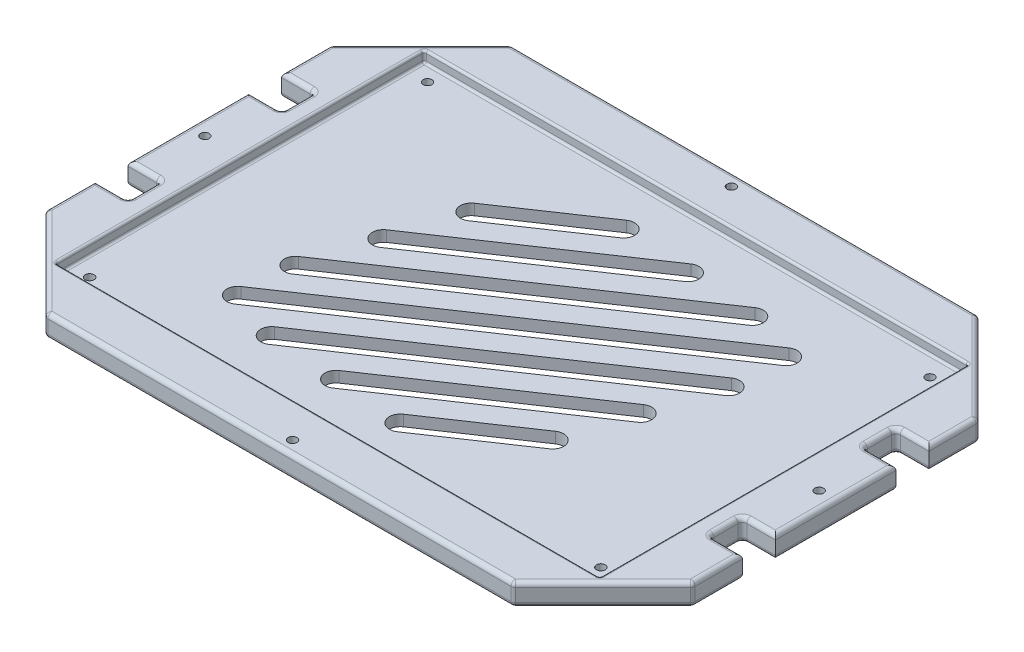
from build123d import *

# Parameters (mm, degrees)
BOSS_EXTRUDE1_DEPTH     = 5
SKETCH4_W               = 248
SKETCH4_H               = 168
CUT_EXTRUDE2_DEPTH      = 5
SKETCH5_R               = 2
SKETCH5_W               = 15
SKETCH5_H               = 15
CUT_EXTRUDE3_DEPTH      = 182.912753813
CUT_EXTRUDE4_DEPTH      = 182.912753813
CUT_EXTRUDE4_DEPTH_BACK = 182.912753813
SKETCH4_3_R             = 2
FILLET1_R               = 2
FILLET2_R               = 1
CUT_EXTRUDE6_DEPTH      = 182.706494105
CUT_EXTRUDE6_DEPTH_BACK = 182.706494105


with BuildPart() as part:
    # Sketch1 → Boss-Extrude1 (new, symmetric)
    with BuildSketch(Plane(origin=(0, 0, 0), x_dir=(1, 0, 0), z_dir=(0, 1, 0))):
        Polygon((-147.5, 64.895923599), (-147.5, -64.895923599), (-106.395923599, -106), (106.395923599, -106), (147.5, -64.895923599), (147.5, 64.895923599), (106.395923599, 106), (-106.395923599, 106), align=None)
    extrude(amount=BOSS_EXTRUDE1_DEPTH, both=True)

    # Sketch4 → Cut-Extrude2 (cut)
    with BuildSketch(Plane(origin=(0, 5, 0), x_dir=(1, 0, 0), z_dir=(0, 1, 0))):
        Rectangle(SKETCH4_W, SKETCH4_H)
    extrude(amount=-CUT_EXTRUDE2_DEPTH, mode=Mode.SUBTRACT)

    # Sketch5 → Cut-Extrude3 (cut, symmetric)
    with BuildSketch(Plane(origin=(0, 5, 0), x_dir=(1, 0, 0), z_dir=(0, 1, 0))):
        with Locations((-140, 0)):
            Circle(SKETCH5_R)
        with Locations((0, 100)):
            Circle(SKETCH5_R)
        with Locations((0, -100)):
            Circle(SKETCH5_R)
        with Locations((-140, 35)):
            Rectangle(SKETCH5_W, SKETCH5_H)
        with Locations((-140, -35)):
            Rectangle(SKETCH5_W, SKETCH5_H)
    cut_extrude3 = extrude(amount=CUT_EXTRUDE3_DEPTH, both=True, mode=Mode.SUBTRACT)

    # Mirror1: Cut-Extrude3 across plane
    add(cut_extrude3.mirror(Plane(origin=(0, 0, 0), x_dir=(0, 0, 1), z_dir=(1, 0, 0))), mode=Mode.SUBTRACT)

    # Sketch4<3> → Cut-Extrude4 (cut, two sides: drawn at the far end of the back side and taken through both)
    with BuildSketch(Plane(origin=(0, 5, 0), x_dir=(1, 0, 0), z_dir=(0, 1, 0)).offset(-CUT_EXTRUDE4_DEPTH_BACK)):
        with Locations((-115.5, 77)):
            Circle(SKETCH4_3_R)
        with Locations((-115.5, -77)):
            Circle(SKETCH4_3_R)
        with Locations((115.5, 75)):
            Circle(SKETCH4_3_R)
        with Locations((115.5, -75)):
            Circle(SKETCH4_3_R)
    extrude(amount=CUT_EXTRUDE4_DEPTH + CUT_EXTRUDE4_DEPTH_BACK, mode=Mode.SUBTRACT)

    # Fillet1
    fillet1_edges = [part.edges().sort_by_distance(p)[0] for p in [
        (140, 5, 42.5),
        (140, 5, 27.5),
        (140, -5, 27.5),
        (140, -5, 42.5),
        (140, 5, -27.5),
        (140, 5, -42.5),
        (140, -5, -42.5),
        (140, -5, -27.5),
        (-140, -5, 42.5),
        (-140, 5, 42.5),
        (-140, -5, 27.5),
        (-140, 5, 27.5),
        (-140, -5, -27.5),
        (-140, 5, -27.5),
        (-140, -5, -42.5),
        (-140, 5, -42.5),
        (132.5, 5, 35),
        (132.5, 0, 27.5),
        (132.5, -5, 35),
        (132.5, 0, 42.5),
        (132.5, 5, -35),
        (132.5, 0, -42.5),
        (132.5, -5, -35),
        (132.5, 0, -27.5),
        (-132.5, 0, 42.5),
        (-132.5, -5, 35),
        (-132.5, 0, 27.5),
        (-132.5, 5, 35),
        (-132.5, 0, -27.5),
        (-132.5, -5, -35),
        (-132.5, 0, -42.5),
        (-132.5, 5, -35),
        (-126.9479618, -5, 85.4479618),
        (0, -5, 106),
        (126.9479618, -5, 85.4479618),
        (147.5, -5, -53.6979618),
        (147.5, -5, 0),
        (147.5, -5, 53.6979618),
        (126.9479618, -5, -85.4479618),
        (0, -5, -106),
        (-126.9479618, -5, -85.4479618),
        (-147.5, -5, -53.6979618),
        (-147.5, -5, 0),
        (-147.5, -5, 53.6979618),
        (-126.9479618, 5, 85.4479618),
        (0, 5, 106),
        (126.9479618, 5, 85.4479618),
        (147.5, 5, -53.6979618),
        (147.5, 5, 0),
        (147.5, 5, 53.6979618),
        (126.9479618, 5, -85.4479618),
        (0, 5, -106),
        (-126.9479618, 5, -85.4479618),
        (-147.5, 5, -53.6979618),
        (-147.5, 5, 0),
        (-147.5, 5, 53.6979618),
        (-147.5, 0, 64.895923599),
        (-147.5, 0, -64.895923599),
        (-106.395923599, 0, -106),
        (106.395923599, 0, -106),
        (147.5, 0, -64.895923599),
        (-106.395923599, 0, 106),
        (147.5, 0, 64.895923599),
        (106.395923599, 0, 106),
    ]]
    fillet(fillet1_edges, radius=FILLET1_R)

    # Fillet2
    fillet2_edges = [part.edges().sort_by_distance(p)[0] for p in [
        (0, 0, 84),
        (124, 0, 0),
        (0, 0, -84),
        (-124, 0, 0),
        (-124, 2.5, 84),
        (124, 2.5, 84),
        (0, 5, 84),
        (124, 2.5, -84),
        (-124, 2.5, -84),
        (124, 5, 0),
        (0, 5, -84),
        (-124, 5, 0),
    ]]
    fillet(fillet2_edges, radius=FILLET2_R)

    # Sketch7 → Cut-Extrude6 (cut, two sides: drawn at the far end of the back side and taken through both)
    with BuildSketch(Plane(origin=(0, 0, 0), x_dir=(1, 0, 0), z_dir=(0, 1, 0)).offset(-CUT_EXTRUDE6_DEPTH_BACK)):
        with BuildLine():
            Line((-77.400196961, -46.197505456), (71.806625914, 54.486773394))
            ThreePointArc((71.806625914, 54.486773394), (78.748045406, 53.138924949), (77.400196961, 46.197505456))
            Line((77.400196961, 46.197505456), (-71.806625914, -54.486773394))
            ThreePointArc((-71.806625914, -54.486773394), (-78.748045406, -53.138924949), (-77.400196961, -46.197505456))
        make_face()
        with BuildLine():
            Line((-76.153437149, -21.228613011), (48.185581913, 62.674952698))
            ThreePointArc((48.185581913, 62.674952698), (55.127001405, 61.327104253), (53.77915296, 54.385684761))
            Line((53.77915296, 54.385684761), (-70.559866102, -29.517880948))
            ThreePointArc((-70.559866102, -29.517880948), (-77.501285594, -28.170032503), (-76.153437149, -21.228613011))
        make_face()
        with BuildLine():
            Line((-66.6174094, 9.333850482), (16.275269975, 65.269560955))
            ThreePointArc((16.275269975, 65.269560955), (23.216689467, 63.92171251), (21.868841022, 56.980293017))
            Line((21.868841022, 56.980293017), (-61.023838353, 1.044582545))
            ThreePointArc((-61.023838353, 1.044582545), (-67.965257845, 2.39243099), (-66.6174094, 9.333850482))
        make_face()
        with BuildLine():
            Line((-57.081381651, 39.896313976), (-15.635041963, 67.864169212))
            ThreePointArc((-15.635041963, 67.864169212), (-8.693622471, 66.516320767), (-10.041470916, 59.574901274))
            Line((-10.041470916, 59.574901274), (-51.487810604, 31.607046038))
            ThreePointArc((-51.487810604, 31.607046038), (-58.429230096, 32.954894483), (-57.081381651, 39.896313976))
        make_face()
        with BuildLine():
            Line((-48.185581913, -62.674952698), (76.153437149, 21.228613011))
            ThreePointArc((76.153437149, 21.228613011), (77.501285594, 28.170032503), (70.559866102, 29.517880948))
            Line((70.559866102, 29.517880948), (-53.77915296, -54.385684761))
            ThreePointArc((-53.77915296, -54.385684761), (-55.127001405, -61.327104253), (-48.185581913, -62.674952698))
        make_face()
        with BuildLine():
            Line((-16.275269975, -65.269560955), (66.6174094, -9.333850482))
            ThreePointArc((66.6174094, -9.333850482), (67.965257845, -2.39243099), (61.023838353, -1.044582545))
            Line((61.023838353, -1.044582545), (-21.868841022, -56.980293017))
            ThreePointArc((-21.868841022, -56.980293017), (-23.216689467, -63.92171251), (-16.275269975, -65.269560955))
        make_face()
        with BuildLine():
            Line((15.635041963, -67.864169212), (57.081381651, -39.896313976))
            ThreePointArc((57.081381651, -39.896313976), (58.429230096, -32.954894483), (51.487810604, -31.607046038))
            Line((51.487810604, -31.607046038), (10.041470916, -59.574901274))
            ThreePointArc((10.041470916, -59.574901274), (8.693622471, -66.516320767), (15.635041963, -67.864169212))
        make_face()
    extrude(amount=CUT_EXTRUDE6_DEPTH + CUT_EXTRUDE6_DEPTH_BACK, mode=Mode.SUBTRACT)


solid = part.part
